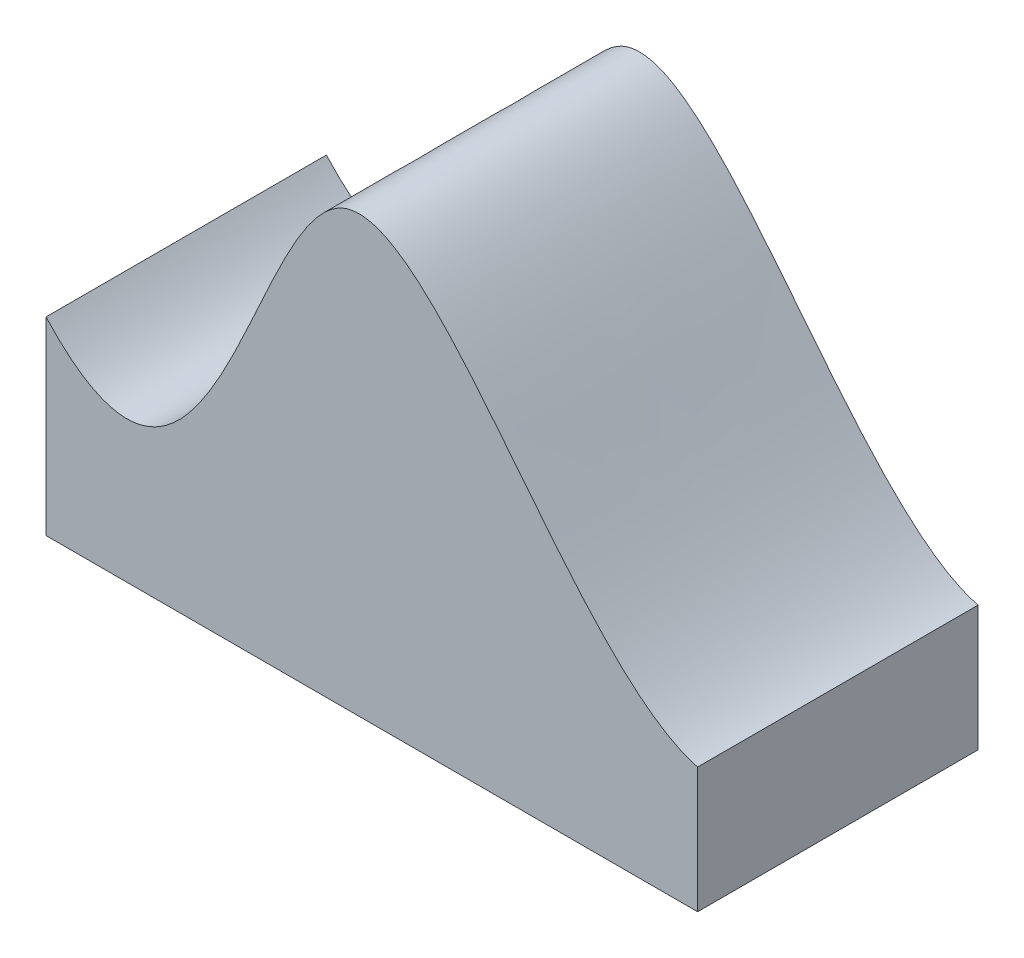
from build123d import *

# Parameters (mm, degrees)
SKETCH_1_W              = 116.205188512
SKETCH_1_H              = 98.81234538
EXTRUDE_1_DEPTH         = 50
SHEET_EXTRUDE_1_1_BACK  = 84
SHEET_EXTRUDE_1_1_DEPTH = 168


with BuildPart() as part:
    # 草图1 → 凸台-拉伸1 (new body)
    with BuildSketch(Plane.XY):
        Rectangle(SKETCH_1_W, SKETCH_1_H)
    extrude(amount=EXTRUDE_1_DEPTH)

    # Surface Cut 4: cut with a surface, the side behind it stays
    # Sheet 凸台-拉伸1: a surface, the sketch's curves swept straight by 168 mm
    with BuildLine(Plane.XY.offset(-SHEET_EXTRUDE_1_1_BACK), mode=Mode.PRIVATE) as sheet_extrude_1_1_path:
        add(Edge.make_bspline(
            [(-77.832747833, 15.553256185), (-31.295772713, -76.721233342), (-15.787269452, 142.067524092), (64.262091576, -94.605051275), (87.005180968, 18.477800083)],
            knots=[0, 0, 0, 0, 0.440401052, 1, 1, 1, 1], degree=3))
    sheet_extrude_1_1 = Shell.extrude(sheet_extrude_1_1_path.wire(), (0 * SHEET_EXTRUDE_1_1_DEPTH, 0 * SHEET_EXTRUDE_1_1_DEPTH, 1 * SHEET_EXTRUDE_1_1_DEPTH))
    split(bisect_by=sheet_extrude_1_1, keep=Keep.BOTTOM)


solid = part.part
